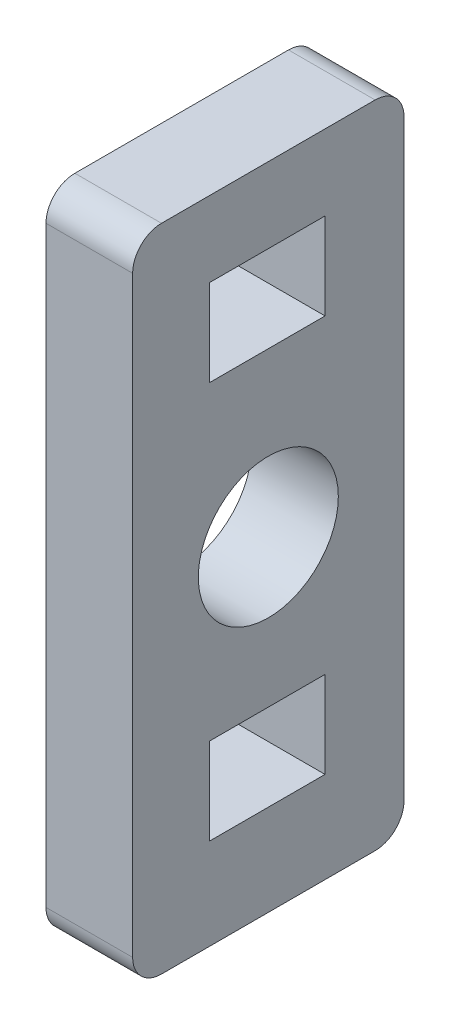
from build123d import *

# Parameters (mm, degrees)
SKETCH1_W           = 9.397838239
SKETCH1_H           = 22.517705726
SKETCH1_R           = 2.425
SKETCH1_W_2         = 4
SKETCH1_H_2         = 3
BOSS_EXTRUDE1_DEPTH = 3
FILLET1_R           = 1


with BuildPart() as part:
    # Sketch1 → Boss-Extrude1 (new body)
    with BuildSketch(Plane(origin=(0, 0, 0), x_dir=(0, 0, -1), z_dir=(1, 0, 0))):
        with Locations((-0.280633356, -0.315954963)):
            Rectangle(SKETCH1_W, SKETCH1_H)
        with Locations((-0.280633356, -0.315954963)):
            Circle(SKETCH1_R, mode=Mode.SUBTRACT)
        with Locations((-0.315702717, -6.918104791)):
            Rectangle(SKETCH1_W_2, SKETCH1_H_2, mode=Mode.SUBTRACT)
        with Locations((-0.315702717, 6.831895209)):
            Rectangle(SKETCH1_W_2, SKETCH1_H_2, mode=Mode.SUBTRACT)
    extrude(amount=BOSS_EXTRUDE1_DEPTH)

    # Fillet1
    fillet1_edges = [part.edges().sort_by_distance(p)[0] for p in [
        (1.5, -11.574807826, 4.979552475),
        (1.5, -11.574807826, -4.418285764),
        (1.5, 10.9428979, 4.979552475),
        (1.5, 10.9428979, -4.418285764),
    ]]
    fillet(fillet1_edges, radius=FILLET1_R)


solid = part.part
